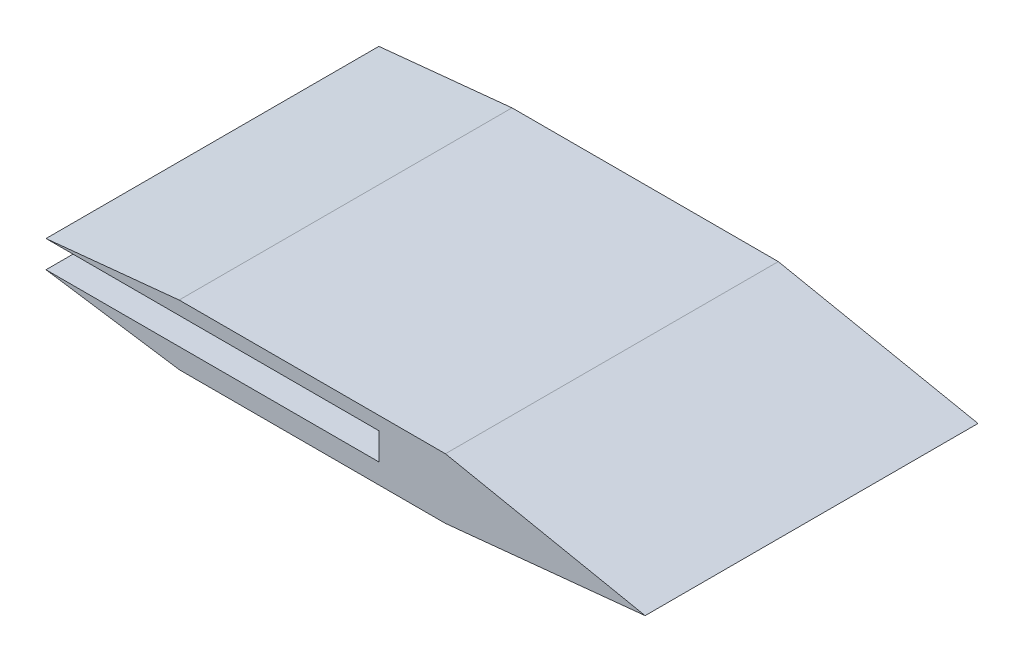
from build123d import *

# Parameters (mm, degrees)
P_IDAT_VYSUNUT_M1_DEPTH = 50


with BuildPart() as part:
    # Skica1 → Přidat vysunutím1 (new body)
    with BuildSketch(Plane.XY):
        Polygon((0, 0), (20, 2), (60, 2), (90, -4.06), (60, -7.06), (20, -7.06), (0, -4.06), (50, -4.06), (50, 0), align=None)
    extrude(amount=P_IDAT_VYSUNUT_M1_DEPTH)


solid = part.part
